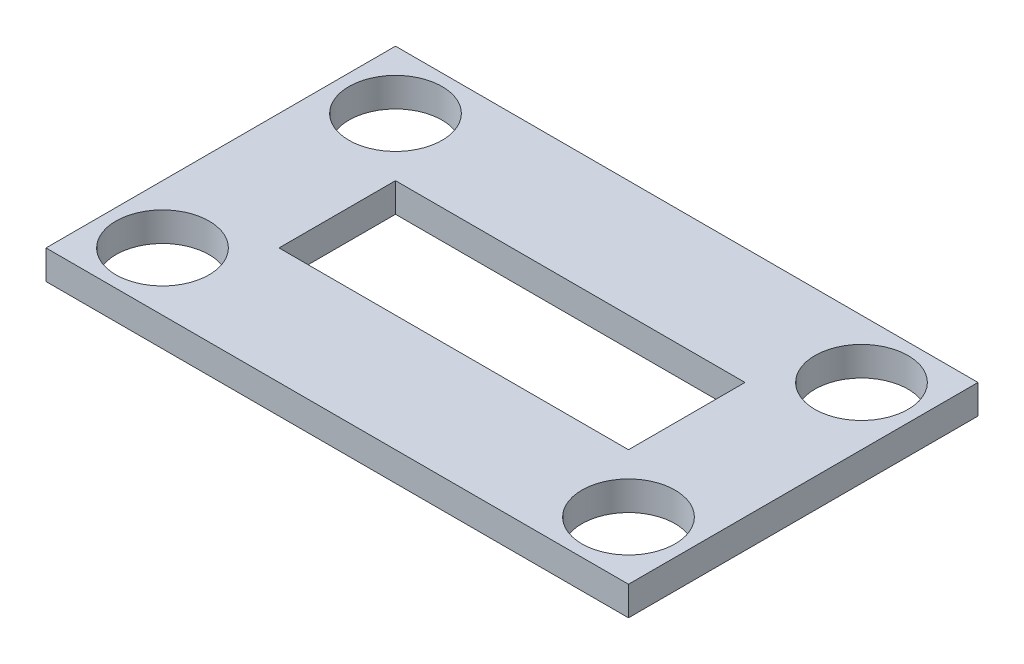
from build123d import *

# Parameters (mm, degrees)
SKETCH2_W           = 50
SKETCH2_H           = 30
SKETCH2_R           = 4
BOSS_EXTRUDE1_DEPTH = 2.5
SKETCH3_W           = 30
SKETCH3_H           = 10
CUT_EXTRUDE1_DEPTH  = 5


with BuildPart() as part:
    # Sketch2 → Boss-Extrude1 (new body)
    with BuildSketch(Plane(origin=(0, 0, 0), x_dir=(1, 0, 0), z_dir=(0, 1, 0))):
        Rectangle(SKETCH2_W, SKETCH2_H)
        with Locations(Location((-20, -10, 0), (0, 0, 270))):
            Circle(SKETCH2_R, mode=Mode.SUBTRACT)
        with Locations(Location((20, -10, 0), (0, 0, 270))):
            Circle(SKETCH2_R, mode=Mode.SUBTRACT)
        with Locations(Location((20, 10, 0), (0, 0, 270))):
            Circle(SKETCH2_R, mode=Mode.SUBTRACT)
        with Locations(Location((-20, 10, 0), (0, 0, 270))):
            Circle(SKETCH2_R, mode=Mode.SUBTRACT)
    extrude(amount=BOSS_EXTRUDE1_DEPTH)

    # Sketch3 → Cut-Extrude1 (cut)
    with BuildSketch(Plane(origin=(0, 2.5, 0), x_dir=(1, 0, 0), z_dir=(0, 1, 0))):
        Rectangle(SKETCH3_W, SKETCH3_H)
    extrude(amount=-CUT_EXTRUDE1_DEPTH, mode=Mode.SUBTRACT)


solid = part.part
